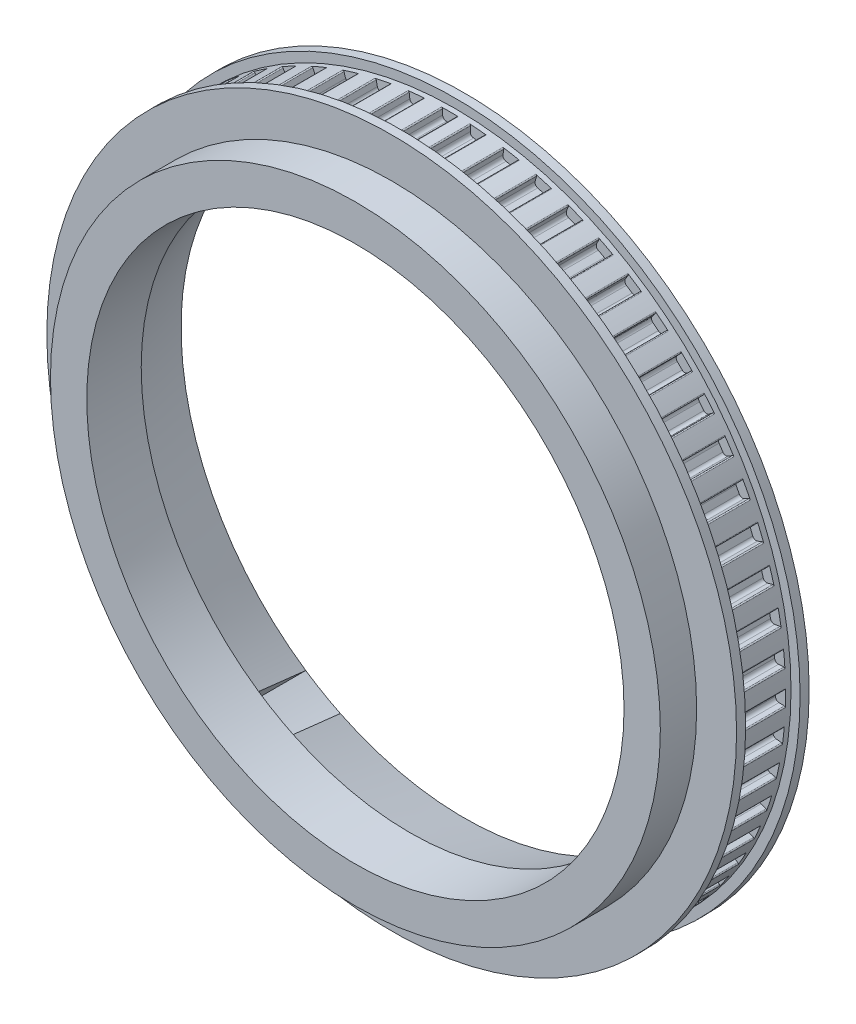
from build123d import *

# Parameters (mm, degrees)
CUT_EXTRUDE1_DEPTH       = 3
FILLET1_R                = 0.15
FILLET2_R                = 0.5
CIRPATTERN1_COUNT        = 63
CIRPATTERN1_ANGLE        = 355.198
FILLET1_OF_CIRPATTERN1_R = 0.15
FILLET2_OF_CIRPATTERN1_R = 0.5
CUT_EXTRUDE2_DEPTH       = 7.5
CIRPATTERN2_COUNT        = 3


with BuildPart() as part:
    # Sketch2 → Revolve1 (revolve)
    with BuildSketch(Plane(origin=(0, 0, 0), x_dir=(1, 0, 0), z_dir=(0, 1, 0))):
        Polygon((37, -2.5), (37, -10), (42, -10), (42, -5), (47.5, -5), (47.5, -3.75), (46.25, -3.75), (46.25, 3.75), (47.5, 3.75), (47.5, 5), (39.009618943, 5), align=None)
    revolve(axis=Axis((0, 0, 10), (0, 0, -1)))

    # Sketch4 → Cut-Extrude1 (cut, symmetric)
    with BuildSketch(Plane(origin=(0, 0, 0), x_dir=(-1, 0, 0), z_dir=(0, 0, -1))):
        with BuildLine():
            Line((-0.999922086, 46.23918961), (-0.970086573, 44.859512169))
            ThreePointArc((-0.970086573, 44.859512169), (0, 44.87), (0.970086573, 44.859512169))
            Line((0.970086573, 44.859512169), (0.999922086, 46.23918961))
            ThreePointArc((0.999922086, 46.23918961), (0, 46.25), (-0.999922086, 46.23918961))
        make_face()
    cut_extrude1 = extrude(amount=CUT_EXTRUDE1_DEPTH, both=True, mode=Mode.SUBTRACT)

    # Fillet1
    fillet1_edges = [part.edges().sort_by_distance(p)[0] for p in [
        (0.999922086, 46.23918961, 0),
        (-0.999922086, 46.23918961, 0),
    ]]
    fillet(fillet1_edges, radius=FILLET1_R)

    # Fillet2
    fillet2_edges = [part.edges().sort_by_distance(p)[0] for p in [
        (-0.970086573, 44.859512169, 0),
        (0.970086573, 44.859512169, 0),
    ]]
    fillet(fillet2_edges, radius=FILLET2_R)

    # CirPattern1: Cut-Extrude1 ×63 about axis
    cirpattern1_axis = Axis((0, 0, 0), (0, 0, 1))
    for i in range(1, CIRPATTERN1_COUNT):
        add(cut_extrude1.rotate(cirpattern1_axis, i * CIRPATTERN1_ANGLE / (CIRPATTERN1_COUNT - 1)), mode=Mode.SUBTRACT)

    # Fillet1 of CirPattern1
    fillet1_of_cirpattern1_edges = [part.edges().sort_by_distance(p)[0] for p in [
        (-3.620824542, 46.108048426, 0),
        (-5.610679837, 45.908417221, 0),
        (-8.205400381, 45.516303723, 0),
        (-10.16538883, 45.119035561, 0),
        (-12.708007097, 44.469866827, 0),
        (-14.618549091, 43.87893028, 0),
        (-17.0836652, 42.979191283, 0),
        (-18.925675082, 42.200489602, 0),
        (-21.288663374, 41.059168425, 0),
        (-23.0437401, 40.100480573, 0),
        (-25.280995135, 38.72897862, 0),
        (-26.931606094, 37.599881558, 0),
        (-29.020778465, 36.011899663, 0),
        (-30.550434621, 34.723672681, 0),
        (-32.470654216, 32.935074234, 0),
        (-33.864074832, 31.500586277, 0),
        (-35.596159318, 29.529238761, 0),
        (-36.839424602, 27.962819869, 0),
        (-38.366071053, 25.828416366, 0),
        (-39.446761212, 24.145714524, 0),
        (-40.752718955, 21.86957699, 0),
        (-41.660038269, 20.087401809, 0),
        (-42.732261236, 17.692268075, 0),
        (-43.457145896, 15.828422872, 0),
        (-44.28492295, 13.338219497, 0),
        (-44.820131607, 11.411323443, 0),
        (-45.39519354, 8.850926702, 0),
        (-45.735379646, 6.880228824, 0),
        (-46.051981786, 4.275216198, 0),
        (-46.193746998, 2.28040309, 0),
        (-46.248726601, -0.343202243, 0),
        (-46.190654733, -2.342203086, 0),
        (-45.983462571, -4.958192211, 0),
        (-45.726133742, -6.941411459, 0),
        (-45.258839592, -9.523651548, 0),
        (-44.804824427, -11.471277524, 0),
        (-44.082096398, -13.993972886, 0),
        (-43.435930354, -15.886549478, 0),
        (-42.464988249, -18.324499257, 0),
        (-41.6331263, -20.143120276, 0),
        (-40.423669497, -22.471970194, 0),
        (-39.414421659, -24.198468243, 0),
        (-37.978532214, -26.39495389, 0),
        (-36.801980524, -28.012081848, 0),
        (-35.154002479, -30.054261091, 0),
        (-33.821900284, -31.545864407, 0),
        (-31.97829637, -33.413336578, 0),
        (-30.503950912, -34.764514649, 0),
        (-28.483138098, -36.438624344, 0),
        (-26.881277579, -37.635879367, 0),
        (-24.70344309, -39.099902807, 0),
        (-22.990069545, -40.131274616, 0),
        (-20.676969196, -41.370586712, 0),
        (-18.869198637, -42.225772258, 0),
        (-16.443939503, -43.227992709, 0),
        (-14.559830935, -43.898448983, 0),
        (-12.04664052, -44.653565951, 0),
        (-10.105015539, -45.132595327, 0),
        (-7.528999749, -45.633065455, 0),
        (-5.549254518, -45.915882593, 0),
        (-2.936146864, -46.156706356, 0),
        (-0.938058357, -46.240486011, 0),
        (1.686037116, -46.219257662, 0),
        (3.682508684, -46.103162904, 0),
        (6.291378167, -45.820094508, 0),
        (8.266288732, -45.505285084, 0),
        (10.833870517, -44.963204397, 0),
        (12.767491403, -44.452825144, 0),
        (15.268136233, -43.657147364, 0),
        (17.141151234, -42.956296795, 0),
        (19.549878529, -41.91497047, 0),
        (21.34357687, -41.030649841, 0),
        (23.636324273, -39.754077462, 0),
        (25.332787526, -38.695120832, 0),
        (27.486651281, -37.196054916, 0),
        (29.068932362, -35.973040896, 0),
        (31.062396113, -34.266456597, 0),
        (32.51468858, -32.891602676, 0),
        (34.32783831, -30.994548182, 0),
        (35.63563426, -29.481588676, 0),
        (37.250357228, -27.413014909, 0),
        (38.400592232, -25.777063763, 0),
        (39.800757911, -23.557635061, 0),
        (40.781941517, -21.815034864, 0),
        (41.953562736, -19.466922555, 0),
        (42.755893256, -17.635081283, 0),
        (43.687265922, -15.1817422, 0),
        (44.302728353, -13.278959315, 0),
        (44.984548374, -10.744901471, 0),
        (45.406994457, -8.790185118, 0),
        (45.832450685, -6.200722878, 0),
        (46.05766033, -4.213600001, 0),
        (46.222502604, -1.5946012, 0),
        (46.248226044, 0.405077529, 0),
        (46.150807648, 3.027449995, 0),
        (45.976787913, 5.019708474, 0),
        (45.618082023, 7.619258008, 0),
        (45.246057512, 9.58419426, 0),
        (44.629647475, 12.134952258, 0),
        (44.063334585, 14.052937248, 0),
        (43.195378124, 16.529422515, 0),
        (42.440434125, 18.381296234, 0),
        (41.329601829, 20.758769537, 0),
        (40.393568351, 22.526032404, 0),
        (39.05095705, 24.780743603, 0),
        (37.943184746, 26.445741271, 0),
        (36.382206664, 28.555166578, 0),
        (35.113761797, 30.101266294, 0),
        (33.350010568, 32.044333276, 0),
        (31.933564465, 33.456090037, 0),
        (29.984659356, 35.213388126, 0),
        (28.434361827, 36.476698967, 0),
        (26.319771728, 38.030673359, 0),
        (24.65110971, 39.132918241, 0),
        (22.391958649, 40.468045269, 0),
        (20.6216015, 41.398213145, 0),
        (18.240457616, 42.501155348, 0),
        (16.386090595, 43.249954162, 0),
        (13.906740697, 44.109693529, 0),
        (11.986888291, 44.669643037, 0),
        (9.434100229, 45.277591067, 0),
        (7.467941103, 45.643097569, 0),
        (4.86721635, 45.993181071, 0),
        (2.874391756, 46.160593281, 0),
    ]]
    fillet(fillet1_of_cirpattern1_edges, radius=FILLET1_OF_CIRPATTERN1_R)

    # Fillet2 of CirPattern1
    fillet2_of_cirpattern1_edges = [part.edges().sort_by_distance(p)[0] for p in [
        (-5.443269282, 44.538609313, 0),
        (-3.512786967, 44.732283954, 0),
        (-9.862075607, 43.772781094, 0),
        (-7.960568975, 44.158195633, 0),
        (-14.182363194, 42.569677873, 0),
        (-12.328827642, 43.142982152, 0),
        (-18.360973858, 40.941318237, 0),
        (-16.573925568, 41.696785143, 0),
        (-22.35616472, 38.903968936, 0),
        (-20.653455689, 39.834051616, 0),
        (-26.128025199, 36.47798239, 0),
        (-24.526664902, 37.573389637, 0),
        (-29.638875707, 33.687593367, 0),
        (-28.154861183, 34.93738244, 0),
        (-32.853644058, 30.560676892, 0),
        (-31.501800101, 31.95236283, 0),
        (-35.740215825, 27.128469784, 0),
        (-34.534046889, 28.648150123, 0),
        (-38.269755148, 23.425258609, 0),
        (-37.221310446, 25.057752267, 0),
        (-40.416992803, 19.488037171, 0),
        (-39.536745936, 21.217036099, 0),
        (-42.160478624, 15.356136957, 0),
        (-41.457222955, 17.164369049, 0),
        (-43.482795788, 11.070834224, 0),
        (-42.9635566, 12.940235867, 0),
        (-44.370734804, 6.674937672, 0),
        (-44.040699116, 8.586834186, 0),
        (-44.815425466, 2.212360792, 0),
        (-44.677890222, 4.14765299, 0),
        (-44.812425468, -2.27231681, 0),
        (-44.868764597, -0.33296183, 0),
        (-44.361764778, -6.73429475, 0),
        (-44.611415471, -4.810250476, 0),
        (-43.467945342, -11.128999405, 0),
        (-43.908413675, -9.239486377, 0),
        (-42.139896107, -15.412529191, 0),
        (-42.766781954, -13.576422993, 0),
        (-40.390883829, -19.54209312, 0),
        (-41.197924816, -17.77773582, 0),
        (-38.238380537, -23.476438271, 0),
        (-39.217514602, -21.801455191, 0),
        (-35.703888997, -27.176261893, 0),
        (-36.845334929, -25.607385536, 0),
        (-32.812727908, -30.604604021, 0),
        (-34.105083054, -29.157506922, 0),
        (-29.593778971, -33.727216698, 0),
        (-31.024133149, -32.416354859, 0),
        (-26.079198378, -36.512906101, 0),
        (-27.633262843, -35.35137458, 0),
        (-22.304095578, -38.933844152, 0),
        (-23.966345761, -37.933246247, 0),
        (-18.306182548, -40.965846513, 0),
        (-20.060013142, -40.136177854, 0),
        (-14.125397061, -42.588614181, 0),
        (-15.953287903, -41.938162872, 0),
        (-9.803503724, -43.785936267, 0),
        (-11.687194814, -43.321200092, 0),
        (-5.383676762, -44.545851934, 0),
        (-7.304350676, -44.271473447, 0),
        (-0.910068724, -44.860769888, 0),
        (-2.84853859, -44.779490036, 0),
        (3.572630587, -44.727544206, 0),
        (1.635729414, -44.840174947, 0),
        (8.019640549, -44.147505767, 0),
        (6.103657045, -44.452921959, 0),
        (12.386537065, -43.126448956, 0),
        (10.510611245, -43.621599595, 0),
        (16.629696343, -41.674573778, 0),
        (14.81256806, -42.354512481, 0),
        (20.706730684, -39.806383965, 0),
        (18.966552423, -40.664318378, 0),
        (24.57691192, -37.540542091, 0),
        (22.931067462, -38.567901745, 0),
        (28.201578272, -34.899683135, 0),
        (26.666509038, -36.086205061, 0),
        (31.544520574, -31.910188369, 0),
        (30.135561375, -33.244019622, 0),
        (34.572343984, -28.601921814, 0),
        (33.303569837, -30.069737879, 0),
        (37.254801588, -25.007931915, 0),
        (36.13888711, -26.595069815, 0),
        (39.565096559, -21.164121392, 0),
        (38.613189351, -22.854726166, 0),
        (41.480149847, -17.108888587, 0),
        (40.701759134, -18.886071677, 0),
        (42.980830729, -12.88274388, 0),
        (42.383732366, -14.728751839, 0),
        (44.052147919, -8.527905, 0),
        (43.642306714, -10.424296843, 0),
        (44.683399329, -4.087875287, 0),
        (44.464909454, -6.015706714, 0),
        (44.868278975, 0.392990891, 0),
        (44.843323067, -1.547021748, 0),
        (44.604939971, 4.869931226, 0),
        (44.773767333, 2.937117433, 0),
        (43.896012985, 9.298222626, 0),
        (44.256937089, 7.391915823, 0),
        (42.748579953, 13.633627985, 0),
        (43.29799529, 11.77287152, 0),
        (41.174103334, 17.832838098, 0),
        (41.906521437, 16.036220287, 0),
        (39.188311609, 21.853904302, 0),
        (40.096415871, 20.139372738, 0),
        (36.811042152, 25.656657531, 0),
        (37.885760926, 24.041339794, 0),
        (34.066043066, 29.203109591, 0),
        (35.296640281, 27.703142148, 0),
        (30.980735947, 32.457832648, 0),
        (32.354918361, 31.088199656, 0),
        (27.585941949, 35.388313138, 0),
        (29.089981953, 34.162696761, 0),
        (23.915573896, 37.965276573, 0),
        (25.534446648, 36.895920295, 0),
        (20.006297498, 40.162979974, 0),
        (21.723831018, 39.260566297, 0),
        (15.897165081, 41.959469043, 0),
        (17.6962018, 41.233012767, 0),
        (11.629225462, 43.336797472, 0),
        (13.491793623, 42.793555646, 0),
        (7.245113887, 44.281206225, 0),
        (9.152607076, 43.926605647, 0),
        (2.788626121, 44.783260984, 0),
        (4.721989138, 44.620843992, 0),
    ]]
    fillet(fillet2_of_cirpattern1_edges, radius=FILLET2_OF_CIRPATTERN1_R)

    # Sketch5 → Cut-Extrude2 (cut)
    with BuildSketch(Plane(origin=(0, 0, -5), x_dir=(-1, 0, 0), z_dir=(0, 0, -1))):
        with BuildLine():
            Line((-38.912566994, -2.75), (-36.897662528, -2.75))
            Line((-36.897662528, -2.75), (-36.897662528, 2.75))
            Line((-36.897662528, 2.75), (-38.912566994, 2.75))
            ThreePointArc((-38.912566994, 2.75), (-39.009618943, 0), (-38.912566994, -2.75))
        make_face()
    cut_extrude2 = extrude(amount=-CUT_EXTRUDE2_DEPTH, mode=Mode.SUBTRACT)

    # CirPattern2: Cut-Extrude2 ×3 about axis
    cirpattern2_axis = Axis((0, 0, 0), (0, 0, 1))
    for i in range(1, CIRPATTERN2_COUNT):
        add(cut_extrude2.rotate(cirpattern2_axis, i * 360 / CIRPATTERN2_COUNT), mode=Mode.SUBTRACT)


solid = part.part
